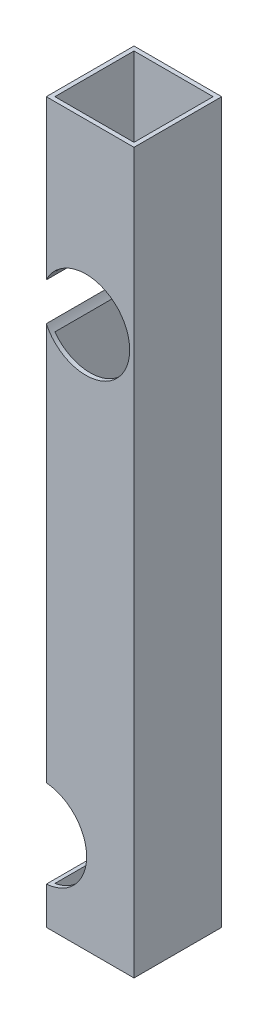
from build123d import *

# Parameters (mm, degrees)
SKETCH1_W           = 25.4
SKETCH1_H           = 25.4
SKETCH1_W_2         = 22.9108
SKETCH1_H_2         = 22.9108
BOSS_EXTRUDE1_DEPTH = 208.28
SKETCH2_R           = 12.75600471
SKETCH2_R_2         = 12.7
CUT_EXTRUDE1_DEPTH  = 209.55


with BuildPart() as part:
    # Sketch1 → Boss-Extrude1 (new body)
    with BuildSketch(Plane(origin=(0, 0, 0), x_dir=(1, 0, 0), z_dir=(0, 1, 0))):
        Rectangle(SKETCH1_W, SKETCH1_H)
        Rectangle(SKETCH1_W_2, SKETCH1_H_2, mode=Mode.SUBTRACT)
    extrude(amount=BOSS_EXTRUDE1_DEPTH)

    # Sketch2 → Cut-Extrude1 (cut)
    with BuildSketch(Plane.XY.offset(12.7)):
        with Locations((-13.77200471, 23.55100471)):
            Circle(SKETCH2_R)
        with Locations((-1.2446, 156.845)):
            Circle(SKETCH2_R_2)
    extrude(amount=-CUT_EXTRUDE1_DEPTH, mode=Mode.SUBTRACT)


solid = part.part
